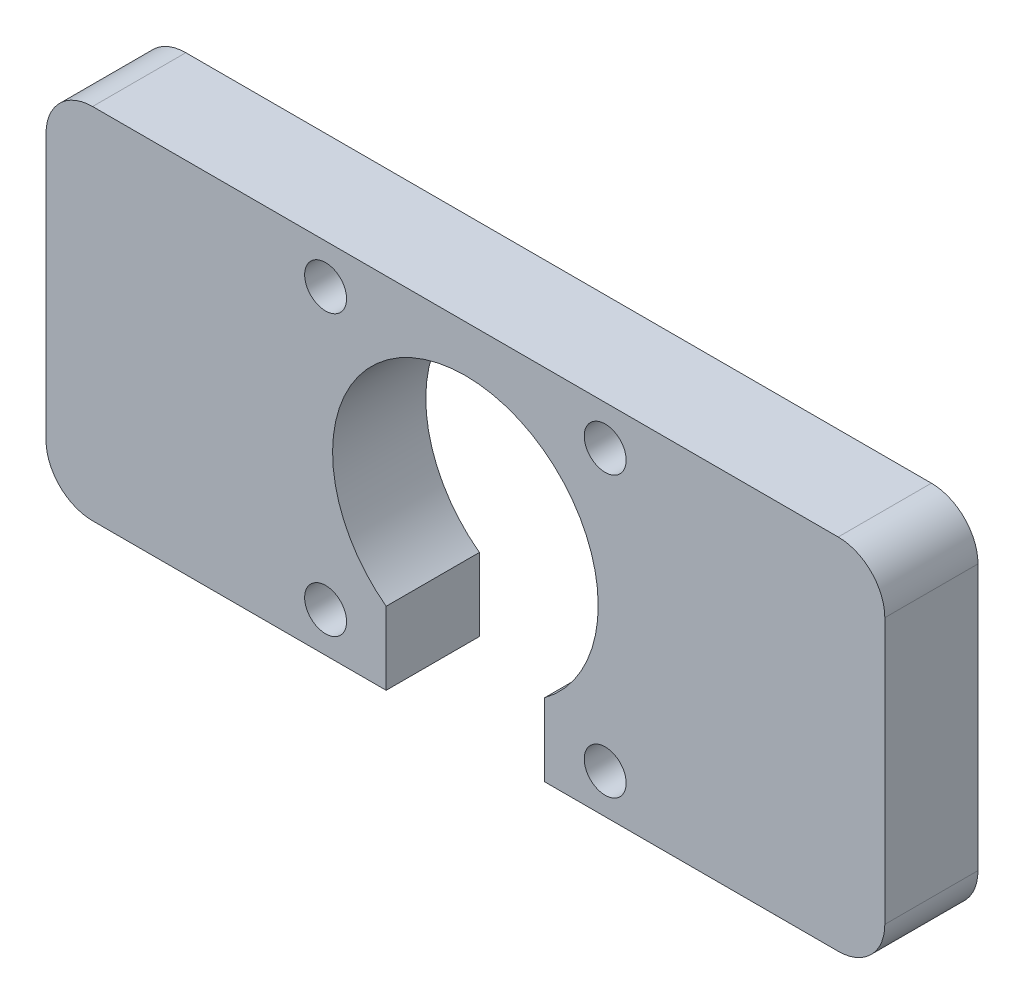
from build123d import *

# Parameters (mm, degrees)
SKETCH1_R           = 2.25
BOSS_EXTRUDE1_DEPTH = 10


with BuildPart() as part:
    # Sketch1 → Boss-Extrude1 (new body)
    with BuildSketch(Plane.XY):
        with BuildLine():
            Line((15, 19.25), (-15, 19.25))
            Line((-15, 19.25), (-30, 19.25))
            Line((-30, 19.25), (-40, 19.25))
            ThreePointArc((-40, 19.25), (-43.535533906, 17.785533906), (-45, 14.25))
            Line((-45, 14.25), (-45, -14.25))
            ThreePointArc((-45, -14.25), (-43.535533906, -17.785533906), (-40, -19.25))
            Line((-40, -19.25), (-30, -19.25))
            Line((-30, -19.25), (-15, -19.25))
            Line((-15, -19.25), (-8.5, -19.25))
            Line((-8.5, -19.25), (-8.5, -16.75))
            Line((-8.5, -16.75), (-8.5, -11.437329234))
            ThreePointArc((-8.5, -11.437329234), (0, 14.25), (8.5, -11.437329234))
            Line((8.5, -11.437329234), (8.5, -16.75))
            Line((8.5, -16.75), (8.5, -19.25))
            Line((8.5, -19.25), (15, -19.25))
            Line((15, -19.25), (30, -19.25))
            Line((30, -19.25), (40, -19.25))
            ThreePointArc((40, -19.25), (43.535533906, -17.785533906), (45, -14.25))
            Line((45, -14.25), (45, 14.25))
            ThreePointArc((45, 14.25), (43.535533906, 17.785533906), (40, 19.25))
            Line((40, 19.25), (30, 19.25))
            Line((30, 19.25), (15, 19.25))
        make_face()
        with Locations((-15, -15)):
            Circle(SKETCH1_R, mode=Mode.SUBTRACT)
        with Locations((15, -15)):
            Circle(SKETCH1_R, mode=Mode.SUBTRACT)
        with Locations((-15, 15)):
            Circle(SKETCH1_R, mode=Mode.SUBTRACT)
        with Locations((15, 15)):
            Circle(SKETCH1_R, mode=Mode.SUBTRACT)
    extrude(amount=BOSS_EXTRUDE1_DEPTH)


solid = part.part
